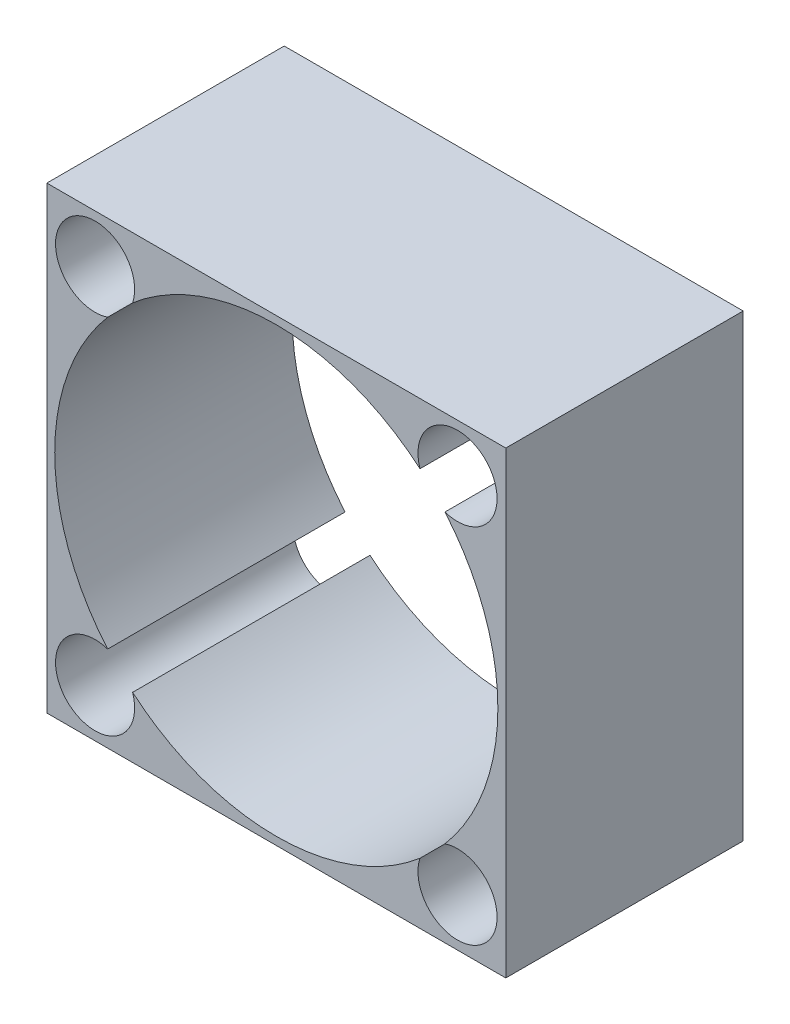
from build123d import *

# Parameters (mm, degrees)
SKETCH_1_W          = 58
SKETCH_1_H          = 58
SKETCH_1_R          = 28
EXTRUDE_1_DEPTH     = 30
SKETCH_2_R          = 5
CUT_EXTRUDE_1_DEPTH = 51.813384064


with BuildPart() as part:
    # 草图1 → 凸台-拉伸1 (new body)
    with BuildSketch(Plane.XY):
        Rectangle(SKETCH_1_W, SKETCH_1_H)
        Circle(SKETCH_1_R, mode=Mode.SUBTRACT)
    extrude(amount=EXTRUDE_1_DEPTH)

    # 草图2 → 切除-拉伸1 (cut, through all)
    with BuildSketch(Plane.XY.offset(30)):
        with Locations((22.9, 22.9)):
            Circle(SKETCH_2_R)
        with Locations((22.9, -22.9)):
            Circle(SKETCH_2_R)
        with Locations((-22.9, -22.9)):
            Circle(SKETCH_2_R)
        with Locations((-22.9, 22.9)):
            Circle(SKETCH_2_R)
    extrude(amount=-CUT_EXTRUDE_1_DEPTH, mode=Mode.SUBTRACT)


solid = part.part
